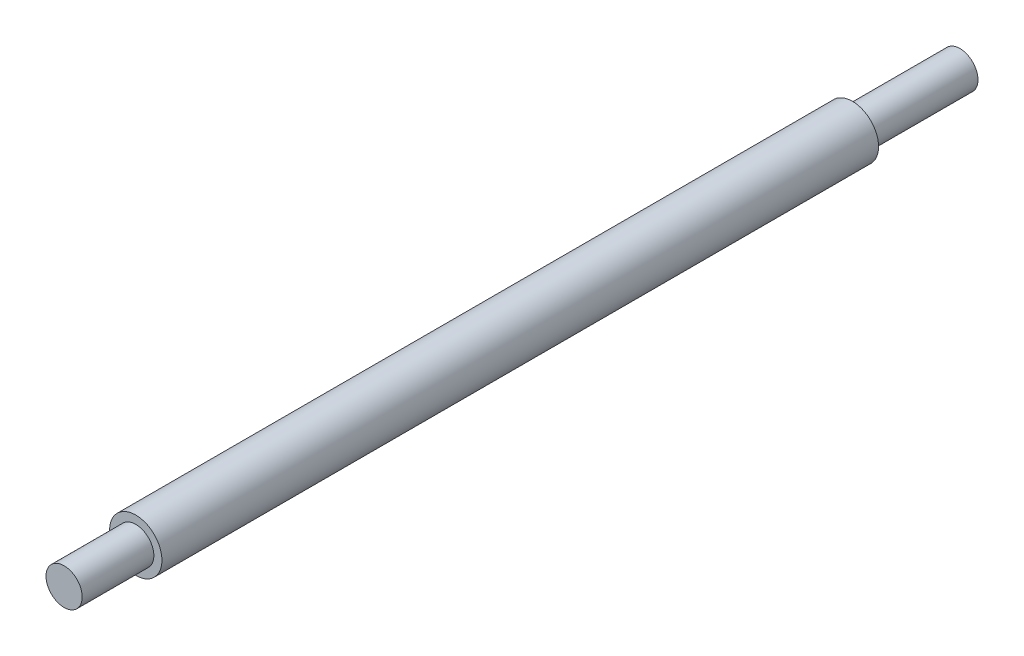
from build123d import *

# Parameters (mm, degrees)
SKETCH1_R           = 1.8542
BOSS_EXTRUDE1_DEPTH = 25.4
SKETCH2_R           = 1.2827
BOSS_EXTRUDE2_DEPTH = 7.62
SKETCH3_R           = 1.2827
CUT_EXTRUDE1_DEPTH  = 2.54


with BuildPart() as part:
    # Sketch1 → Boss-Extrude1 (new, symmetric)
    with BuildSketch(Plane.XY):
        Circle(SKETCH1_R)
    extrude(amount=BOSS_EXTRUDE1_DEPTH, both=True)

    # Sketch2 → Boss-Extrude2 (add)
    with BuildSketch(Plane.XY.offset(25.4)):
        with Locations(Location((0, 0, 0), (0, 0, 180))):
            Circle(SKETCH2_R)
    boss_extrude2 = extrude(amount=BOSS_EXTRUDE2_DEPTH)

    # Mirror1: Boss-Extrude2 across plane
    add(boss_extrude2.mirror(Plane.XY))

    # Sketch3 → Cut-Extrude1 (cut)
    with BuildSketch(Plane.XY.offset(33.02)):
        with Locations(Location((0, 0, 0), (0, 0, 180))):
            Circle(SKETCH3_R)
    extrude(amount=-CUT_EXTRUDE1_DEPTH, mode=Mode.SUBTRACT)


solid = part.part
